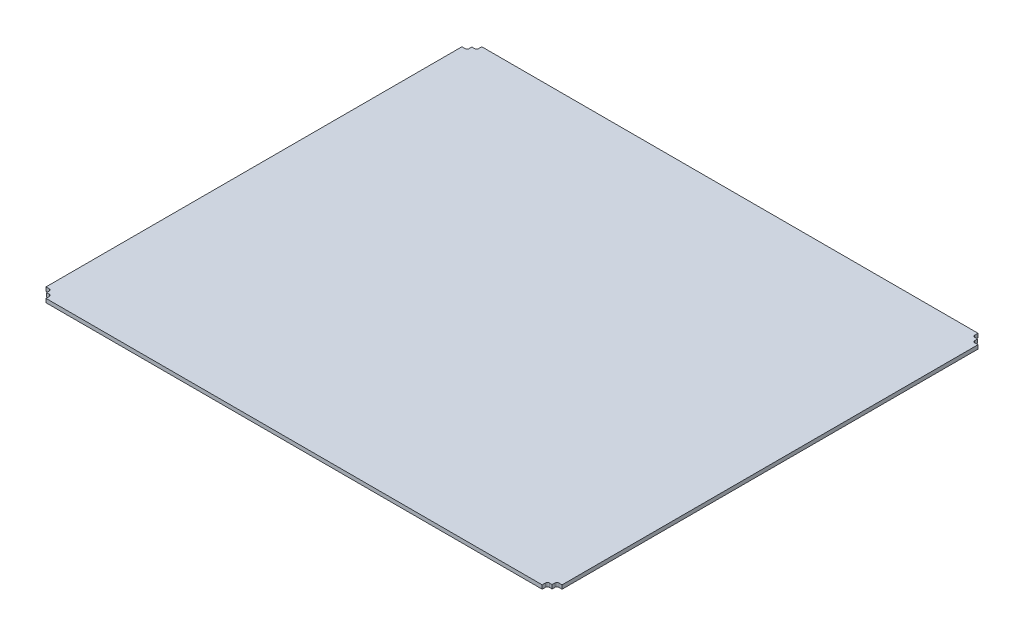
from build123d import *

# Parameters (mm, degrees)
SKETCH1_W            = 857.25
SKETCH1_H            = 723.9
BOSS_EXTRUDE1_DEPTH  = 3.175
CUT_EXTRUDE1_DEPTH   = 562.041456245
MIRROR2_COPY_1_DEPTH = 562.041456245


with BuildPart() as part:
    # Sketch1 → Boss-Extrude1 (new, symmetric)
    with BuildSketch(Plane(origin=(0, 0, 0), x_dir=(1, 0, 0), z_dir=(0, 1, 0))):
        Rectangle(SKETCH1_W, SKETCH1_H)
    extrude(amount=BOSS_EXTRUDE1_DEPTH, both=True)

    # Sketch2 → Cut-Extrude1 (cut, through all)
    with BuildSketch(Plane(origin=(0, 3.175, 0), x_dir=(1, 0, 0), z_dir=(0, 1, 0))):
        with BuildLine():
            Line((-428.625, 361.95), (-412.115, 361.95))
            Line((-412.115, 361.95), (-412.115, 356.489))
            ThreePointArc((-412.115, 356.489), (-413.04493597, 354.24393597), (-415.29, 353.314))
            Line((-415.29, 353.314), (-419.989, 353.314))
            Line((-419.989, 353.314), (-419.989, 348.615))
            ThreePointArc((-419.989, 348.615), (-420.91893597, 346.36993597), (-423.164, 345.44))
            Line((-423.164, 345.44), (-428.625, 345.44))
            Line((-428.625, 345.44), (-428.625, 361.95))
        make_face()
    cut_extrude1 = extrude(amount=-CUT_EXTRUDE1_DEPTH, mode=Mode.SUBTRACT)

    # Mirror1: Cut-Extrude1 across plane
    add(cut_extrude1.mirror(Plane(origin=(0, 0, 0), x_dir=(0, 0, 1), z_dir=(1, 0, 0))), mode=Mode.SUBTRACT)

    # Mirror2: Cut-Extrude1 across plane
    add(cut_extrude1.mirror(Plane.XY), mode=Mode.SUBTRACT)

    # Mirror2 copy 1 sketch → Mirror2 copy 1 (cut, through all)
    with BuildSketch(Plane(origin=(0, 3.175, 0), x_dir=(-1, 0, 0), z_dir=(0, 1, 0))):
        with BuildLine():
            Line((-428.625, 361.95), (-412.115, 361.95))
            Line((-412.115, 361.95), (-412.115, 356.489))
            ThreePointArc((-412.115, 356.489), (-413.04493597, 354.24393597), (-415.29, 353.314))
            Line((-415.29, 353.314), (-419.989, 353.314))
            Line((-419.989, 353.314), (-419.989, 348.615))
            ThreePointArc((-419.989, 348.615), (-420.91893597, 346.36993597), (-423.164, 345.44))
            Line((-423.164, 345.44), (-428.625, 345.44))
            Line((-428.625, 345.44), (-428.625, 361.95))
        make_face()
    extrude(amount=-MIRROR2_COPY_1_DEPTH, mode=Mode.SUBTRACT)


solid = part.part
